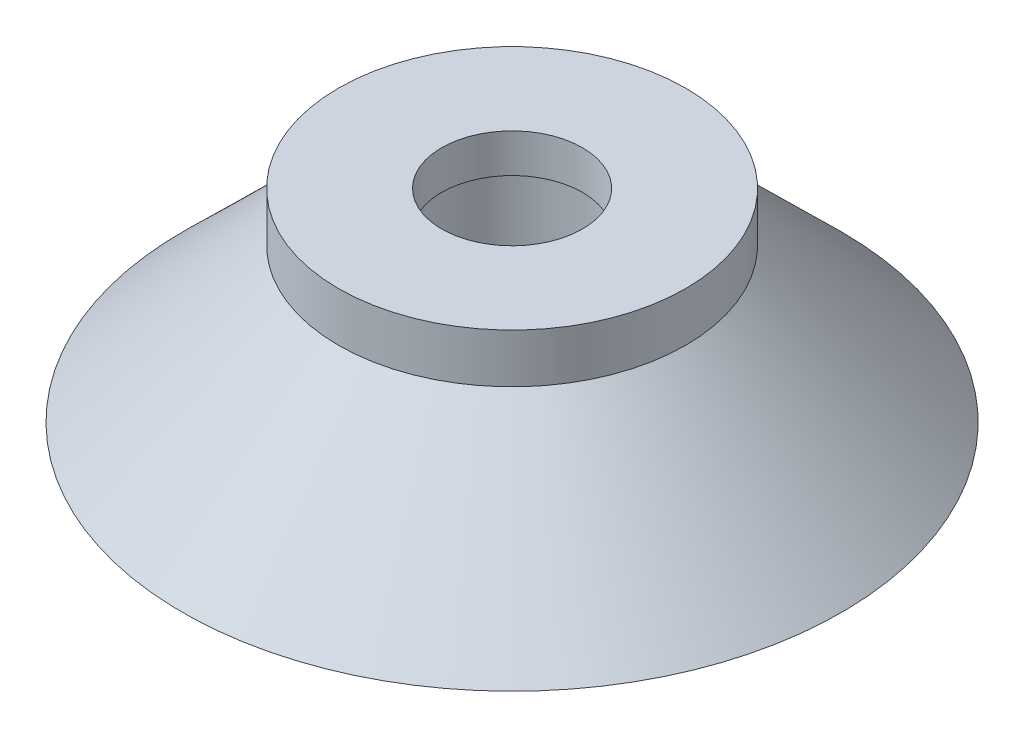
from build123d import *


with BuildPart() as part:
    # Sketch1 → Revolve1 (revolve)
    with BuildSketch(Plane(origin=(0, 0, 0), x_dir=(0, 0, -1), z_dir=(1, 0, 0))):
        Polygon((2.73, 6.35), (2.73, 7.85), (6.73, 7.85), (6.73, 5.945), (12.7762, 0), (3.2, 0), (3.2, 6.35), align=None)
    revolve(axis=Axis((0, 0, 0), (0, 1, 0)))


solid = part.part
